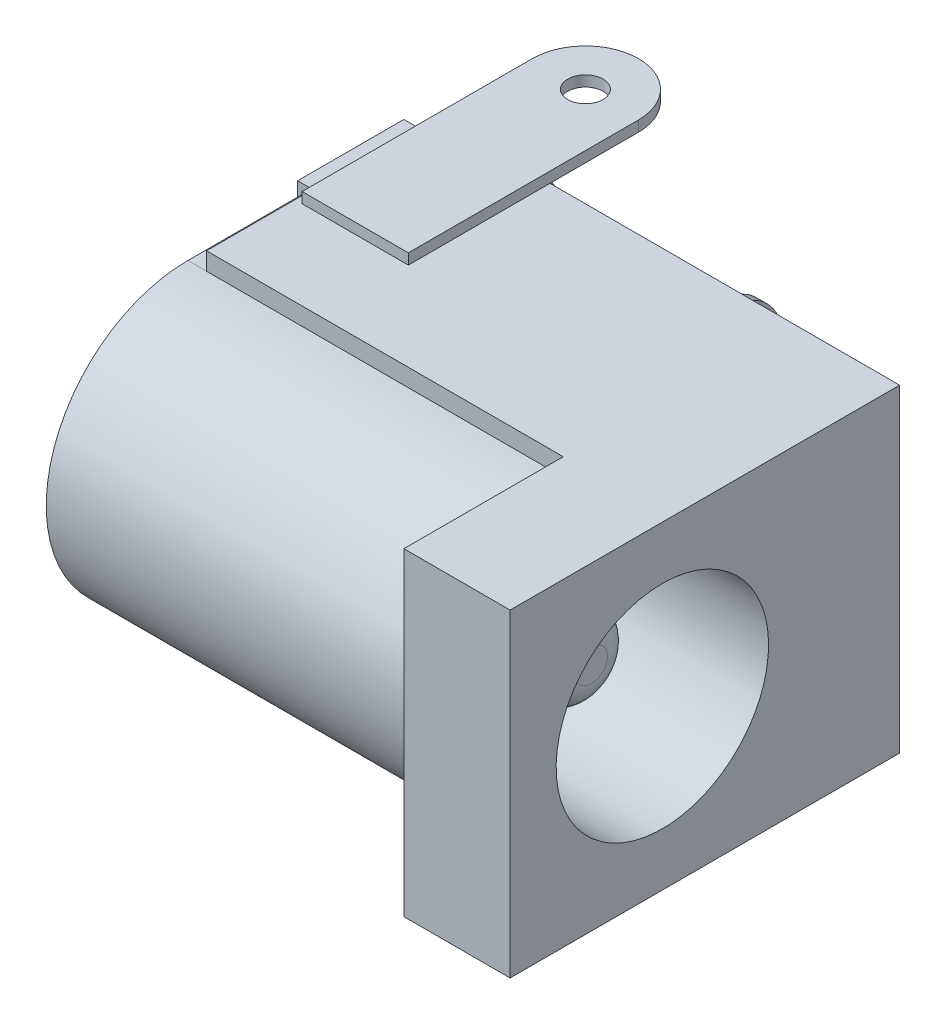
from build123d import *

# Parameters (mm, degrees)
BOSS_EXTRUDE1_DEPTH  = 6.5
BOSS_EXTRUDE2_REACH  = 18.078
SKETCH2_R            = 4
BOSS_EXTRUDE3_DEPTH  = 3
CUT_EXTRUDE1_START   = -0.4
CUT_EXTRUDE1_DEPTH   = 0.4
SKETCH5_W            = 3
SKETCH5_H            = 4
BOSS_EXTRUDE4_DEPTH  = 0.3
SKETCH6_W            = 3
SKETCH6_H            = 0.3
BOSS_EXTRUDE5_DEPTH  = 4
SKETCH7_R            = 0.5
CUT_EXTRUDE4_DEPTH   = 17.01530518
SKETCH8_W            = 6.5
SKETCH8_H            = 0.5
BOSS_EXTRUDE6_DEPTH  = 0.2
BOSS_EXTRUDE7_DEPTH  = 0.3
SKETCH10_W           = 0.3
SKETCH10_H           = 3
BOSS_EXTRUDE8_DEPTH  = 4
SKETCH12_W           = 0.3
SKETCH12_H           = 3
BOSS_EXTRUDE9_DEPTH  = 4
SKETCH11_R           = 0.5
CUT_EXTRUDE5_DEPTH   = 19.364367672
SKETCH13_R           = 3
CUT_EXTRUDE6_DEPTH   = 10
SKETCH14_R           = 1.5
BOSS_EXTRUDE10_DEPTH = 0.5
SKETCH15_R           = 0.5
CUT_EXTRUDE7_DEPTH   = 1
FILLET1_R            = 0.5
FILLET2_R            = 0.25
SKETCH16_R           = 1.2
BOSS_EXTRUDE11_DEPTH = 8
FILLET4_R            = 0.75


with BuildPart() as part:
    # Sketch1 → Boss-Extrude1 (new body)
    with BuildSketch(Plane.XY):
        Polygon((7, 4.5), (-5.873443246, 4.5), (-5.873443246, 4), (-7, 4), (-7, -4), (-5.873443246, -4), (-5.873443246, -4.5), (7, -4.5), align=None)
    extrude(amount=BOSS_EXTRUDE1_DEPTH)

    # Boss-Extrude2: up to this face of the body (flat: up to its plane)
    boss_extrude2_end = Plane(part.part.faces().sort_by_distance((-7, 0, 3.25))[0])
    # Sketch2 → Boss-Extrude2 (add, up to the picked face)
    with BuildSketch(Plane(origin=(7, 0, 0), x_dir=(0, 0, -1), z_dir=(1, 0, 0)), mode=Mode.PRIVATE) as boss_extrude2_sk1:
        with Locations((-6.5, 0)):
            Circle(SKETCH2_R)
    boss_extrude2_tool1 = split(extrude(boss_extrude2_sk1.sketch, amount=-BOSS_EXTRUDE2_REACH, mode=Mode.PRIVATE), bisect_by=boss_extrude2_end, keep=Keep.BOTH, mode=Mode.PRIVATE)
    add(boss_extrude2_tool1.solids().sort_by(Axis((7, 0, 6.5), (-1, 0, 0)))[0])

    # Sketch3 → Boss-Extrude3 (add)
    with BuildSketch(Plane(origin=(7, 0, 0), x_dir=(0, 0, -1), z_dir=(1, 0, 0))):
        with BuildLine():
            Line((-11, -4.5), (-6.5, -4.5))
            Line((-6.5, -4.5), (-6.5, -4))
            ThreePointArc((-6.5, -4), (-10.5, 0), (-6.5, 4))
            Line((-6.5, 4), (-6.5, 4.5))
            Line((-6.5, 4.5), (-11, 4.5))
            Line((-11, 4.5), (-11, 0.782604766))
            Line((-11, 0.782604766), (-11, -4.5))
        make_face()
    extrude(amount=-BOSS_EXTRUDE3_DEPTH)

    # Sketch4 → Cut-Extrude1 (cut)
    with BuildSketch(Plane.ZY.offset(7).offset(CUT_EXTRUDE1_START)):
        with BuildLine():
            Line((3, 4), (3, 2))
            Line((3, 2), (0, 2))
            Line((0, 2), (0, -2))
            Line((0, -2), (3, -2))
            Line((3, -2), (3, -4))
            Line((3, -4), (6.5, -4))
            ThreePointArc((6.5, -4), (10.5, 0), (6.5, 4))
            Line((6.5, 4), (3, 4))
        make_face()
    extrude(amount=CUT_EXTRUDE1_DEPTH, mode=Mode.SUBTRACT)

    # Sketch5 → Boss-Extrude4 (add)
    with BuildSketch(Plane(origin=(0, 4.5, 0), x_dir=(1, 0, 0), z_dir=(0, 1, 0))):
        with Locations((-4.373443246, -2)):
            Rectangle(SKETCH5_W, SKETCH5_H)
    extrude(amount=BOSS_EXTRUDE4_DEPTH)

    # Sketch6 → Boss-Extrude5 (add)
    with BuildSketch(Plane(origin=(0, 0, 0), x_dir=(-1, 0, 0), z_dir=(0, 0, -1))):
        with Locations((4.373443246, 4.65)):
            Rectangle(SKETCH6_W, SKETCH6_H)
    extrude(amount=BOSS_EXTRUDE5_DEPTH)

    # Sketch7 → Cut-Extrude4 (cut, through all)
    with BuildSketch(Plane(origin=(0, 4.8, 0), x_dir=(1, 0, 0), z_dir=(0, 1, 0))):
        with Locations(Location((-4.373443246, 2.5, 0), (0, 0, 270))):
            Circle(SKETCH7_R)
        with BuildLine():
            Line((-5.873443246, 4), (-5.873443246, 2.5))
            ThreePointArc((-5.873443246, 2.5), (-5.434103418, 3.560660172), (-4.373443246, 4))
            Line((-4.373443246, 4), (-5.873443246, 4))
        make_face()
        with BuildLine():
            Line((-2.873443246, 4), (-4.373443246, 4))
            ThreePointArc((-4.373443246, 4), (-3.312783074, 3.560660172), (-2.873443246, 2.5))
            Line((-2.873443246, 2.5), (-2.873443246, 4))
        make_face()
    extrude(amount=-CUT_EXTRUDE4_DEPTH, mode=Mode.SUBTRACT)

    # Sketch8 → Boss-Extrude6 (add)
    with BuildSketch(Plane.ZY.offset(5.873443246)):
        with Locations((3.25, 4.25)):
            Rectangle(SKETCH8_W, SKETCH8_H)
        with Locations((3.25, -4.25)):
            Rectangle(SKETCH8_W, SKETCH8_H)
    extrude(amount=BOSS_EXTRUDE6_DEPTH)

    # Sketch9 → Boss-Extrude7 (add)
    with BuildSketch(Plane.ZY.offset(6.6)):
        with BuildLine():
            Line((5.177124344, 1.5), (0, 1.5))
            Line((0, 1.5), (0, -1.5))
            Line((0, -1.5), (5.177124344, -1.5))
            ThreePointArc((5.177124344, -1.5), (8.5, 0), (5.177124344, 1.5))
        make_face()
    extrude(amount=BOSS_EXTRUDE7_DEPTH)

    # Sketch10 → Boss-Extrude8 (add)
    with BuildSketch(Plane(origin=(0, 0, 0), x_dir=(-1, 0, 0), z_dir=(0, 0, -1))):
        with Locations((6.75, 0)):
            Rectangle(SKETCH10_W, SKETCH10_H)
    extrude(amount=BOSS_EXTRUDE8_DEPTH)

    # Sketch12 → Boss-Extrude9 (add)
    with BuildSketch(Plane(origin=(0, 0, 0), x_dir=(-1, 0, 0), z_dir=(0, 0, -1))):
        with Locations((0.45, 0)):
            Rectangle(SKETCH12_W, SKETCH12_H)
    extrude(amount=BOSS_EXTRUDE9_DEPTH)

    # Sketch11 → Cut-Extrude5 (cut, through all)
    with BuildSketch(Plane.ZY.offset(6.9)):
        with Locations(Location((-2.5, 0, 0), (0, 0, 270))):
            Circle(SKETCH11_R)
        with BuildLine():
            Line((-2.5, 1.5), (-4, 1.5))
            Line((-4, 1.5), (-4, 0))
            ThreePointArc((-4, 0), (-3.560660172, 1.060660172), (-2.5, 1.5))
        make_face()
        with BuildLine():
            ThreePointArc((-2.5, -1.5), (-3.560660172, -1.060660172), (-4, 0))
            Line((-4, 0), (-4, -1.5))
            Line((-4, -1.5), (-2.5, -1.5))
        make_face()
    extrude(amount=-CUT_EXTRUDE5_DEPTH, mode=Mode.SUBTRACT)

    # Sketch13 → Cut-Extrude6 (cut)
    with BuildSketch(Plane(origin=(7, 0, 0), x_dir=(0, 0, -1), z_dir=(1, 0, 0))):
        with Locations(Location((-6.7, 0, 0), (0, 0, 90))):
            Circle(SKETCH13_R)
    extrude(amount=-CUT_EXTRUDE6_DEPTH, mode=Mode.SUBTRACT)

    # Sketch14 → Boss-Extrude10 (add)
    with BuildSketch(Plane.ZY.offset(6.9)):
        with Locations((6.5, 0)):
            Circle(SKETCH14_R)
    extrude(amount=BOSS_EXTRUDE10_DEPTH)

    # Sketch15 → Cut-Extrude7 (cut)
    with BuildSketch(Plane.ZY.offset(7.4)):
        with Locations((6.5, 0)):
            Circle(SKETCH15_R)
    extrude(amount=-CUT_EXTRUDE7_DEPTH, mode=Mode.SUBTRACT)

    # Fillet1
    fillet1_edges = [part.edges().sort_by_distance(p)[0] for p in [
        (-7.4, 0, 6),
    ]]
    fillet(fillet1_edges, radius=FILLET1_R)

    # Fillet2
    fillet2_edges = [part.edges().sort_by_distance(p)[0] for p in [
        (-7.4, 0, 5),
    ]]
    fillet(fillet2_edges, radius=FILLET2_R)

    # Sketch16 → Boss-Extrude11 (add)
    with BuildSketch(Plane(origin=(-3, 0, 0), x_dir=(0, 0, -1), z_dir=(1, 0, 0))):
        with Locations(Location((-6.7, 0, 0), (0, 0, 90))):
            Circle(SKETCH16_R)
    extrude(amount=BOSS_EXTRUDE11_DEPTH)

    # Fillet4
    fillet4_edges = [part.edges().sort_by_distance(p)[0] for p in [
        (5, -1.2, 6.7),
    ]]
    fillet(fillet4_edges, radius=FILLET4_R)


solid = part.part
